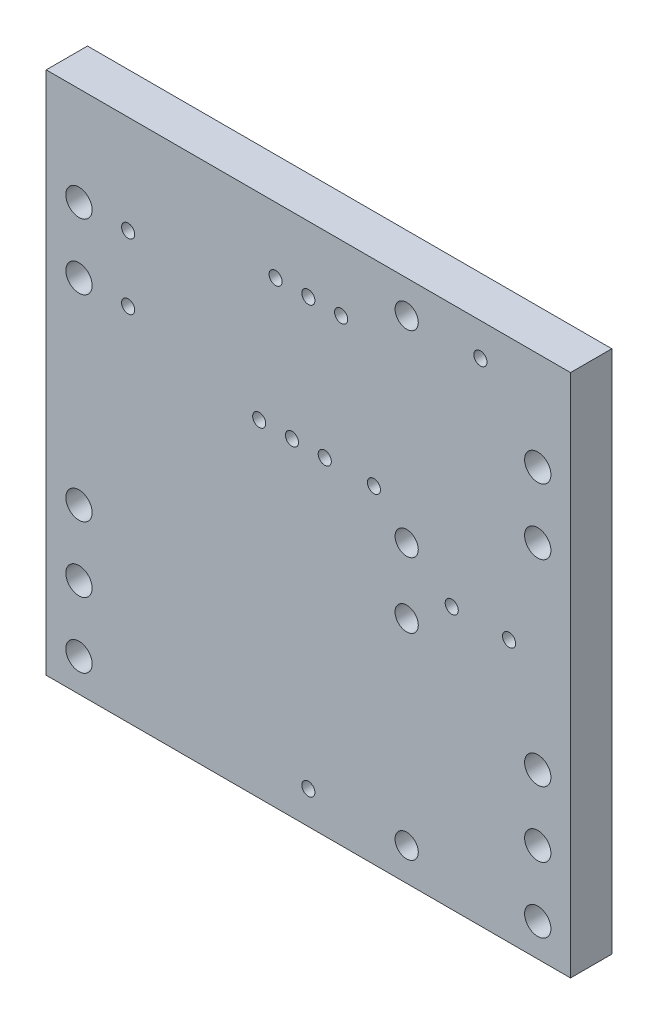
from build123d import *

# Parameters (mm, degrees)
SKETCH1_W           = 20.32
SKETCH1_H           = 20.32
BOARD_OUTLINE_DEPTH = 1.6
SKETCH2_R           = 0.254
NPTH_DEPTH          = 29.78132728
SKETCH3_R           = 0.51
SKETCH3_R_2         = 0.45
PTH_DEPTH           = 29.78132728


with BuildPart() as part:
    # Sketch1 → Board_Outline (new body)
    with BuildSketch(Plane.XY):
        with Locations((10.16, 10.16)):
            Rectangle(SKETCH1_W, SKETCH1_H)
    extrude(amount=BOARD_OUTLINE_DEPTH)

    # Sketch2 → NPTH (cut, through all)
    with BuildSketch(Plane.XY):
        with Locations((9.525, 12.7)):
            Circle(SKETCH2_R)
        with Locations((11.43, 17.78)):
            Circle(SKETCH2_R)
        with Locations((10.16, 17.78)):
            Circle(SKETCH2_R)
        with Locations((10.795, 12.7)):
            Circle(SKETCH2_R)
        with Locations((3.175, 13.97)):
            Circle(SKETCH2_R)
        with Locations((8.89, 17.78)):
            Circle(SKETCH2_R)
        with Locations((15.7163, 10.16)):
            Circle(SKETCH2_R)
        with Locations((16.8275, 19.05)):
            Circle(SKETCH2_R)
        with Locations((8.255, 12.7)):
            Circle(SKETCH2_R)
        with Locations((17.9388, 10.16)):
            Circle(SKETCH2_R)
        with Locations((12.7, 12.7)):
            Circle(SKETCH2_R)
        with Locations((10.16, 1.27)):
            Circle(SKETCH2_R)
        with Locations((3.175, 16.51)):
            Circle(SKETCH2_R)
    extrude(amount=NPTH_DEPTH, mode=Mode.SUBTRACT)

    # Sketch3 → PTH (cut, through all)
    with BuildSketch(Plane.XY):
        with Locations((1.27, 1.27)):
            Circle(SKETCH3_R)
        with Locations((1.27, 3.81)):
            Circle(SKETCH3_R)
        with Locations((1.27, 6.35)):
            Circle(SKETCH3_R)
        with Locations((19.05, 16.51)):
            Circle(SKETCH3_R)
        with Locations((19.05, 13.97)):
            Circle(SKETCH3_R)
        with Locations((1.27, 16.51)):
            Circle(SKETCH3_R)
        with Locations((1.27, 13.97)):
            Circle(SKETCH3_R)
        with Locations((19.05, 1.27)):
            Circle(SKETCH3_R)
        with Locations((19.05, 3.81)):
            Circle(SKETCH3_R)
        with Locations((19.05, 6.35)):
            Circle(SKETCH3_R)
        with Locations((13.97, 8.89)):
            Circle(SKETCH3_R_2)
        with Locations((13.97, 1.27)):
            Circle(SKETCH3_R_2)
        with Locations((13.97, 11.43)):
            Circle(SKETCH3_R_2)
        with Locations((13.97, 19.05)):
            Circle(SKETCH3_R_2)
    extrude(amount=PTH_DEPTH, mode=Mode.SUBTRACT)


solid = part.part
